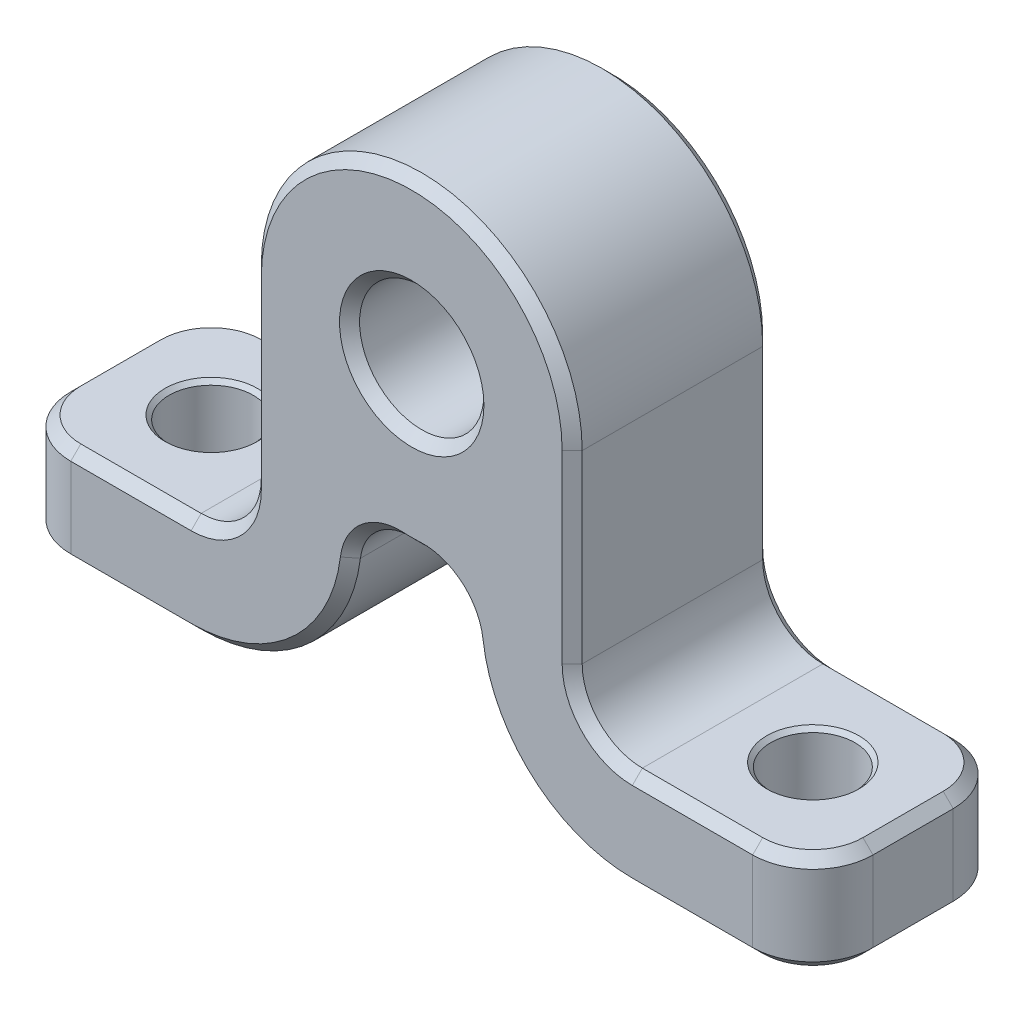
from build123d import *

# Parameters (mm, degrees)
SKETCH_1_R        = 8
SKETCH_1_R_2      = 3.1
EXTRUDE_1_DEPTH   = 5
SKETCH_1_W        = 40
SKETCH_1_H        = 5
EXTRUDE_1_2_DEPTH = 5
CHAMFER_7_SIZE    = 0.5
EXTRUDE1_START    = -10
EXTRUDE1_DEPTH    = 10
FILLET1_R         = 3
EXTRUDE2_START    = -4.5
EXTRUDE2_DEPTH    = 4.5
FILLET2_R         = 8
SKETCH3_R         = 2.1
EXTRUDE3_DEPTH    = 29.869431931
CHAMFER2_SIZE     = 0.2
EXTRUDE4_DEPTH    = 27.952441448
FILLET3_R         = 2.5
FILLET4_R         = 3
CHAMFER4_SIZE     = 0.5


with BuildPart() as part:
    # 草图1 → 凸台-拉伸1 (new, symmetric)
    with BuildSketch(Plane.XY):
        Circle(SKETCH_1_R)
        Circle(SKETCH_1_R_2, mode=Mode.SUBTRACT)
    extrude(amount=EXTRUDE_1_DEPTH, both=True)

    # 倒角7
    chamfer_7_edges = [part.edges().sort_by_distance(p)[0] for p in [
        (-3.1, 0, -5),
        (-3.1, 0, 5),
    ]]
    chamfer(chamfer_7_edges, length=CHAMFER_7_SIZE)



with BuildPart() as body_2:
    # 草图1 → Extrude 1 2 (new, symmetric)
    with BuildSketch(Plane.XY):
        with Locations((0, -14.71)):
            Rectangle(SKETCH_1_W, SKETCH_1_H)
    extrude(amount=EXTRUDE_1_2_DEPTH, both=True)


with BuildPart() as part_1:
    add(part.part)

    add(body_2.part)  # Extrude1 merges body 2
    # Sketch1 → Extrude1 (add)
    with BuildSketch(Plane(origin=(0, 0, -5), x_dir=(-1, 0, 0), z_dir=(0, 0, -1)).offset(EXTRUDE1_START)):
        with BuildLine():
            ThreePointArc((8, 0), (0, -8), (-8, 0))
            Line((-8, 0), (-8, -12.21))
            Line((-8, -12.21), (8, -12.21))
            Line((8, -12.21), (8, 0))
        make_face()
    extrude(amount=EXTRUDE1_DEPTH)

    # Fillet1
    fillet1_edges = [part_1.edges().sort_by_distance(p)[0] for p in [
        (8, -12.21, 0),
        (-8, -12.21, 0),
    ]]
    fillet(fillet1_edges, radius=FILLET1_R)

    # Sketch2 → Extrude2 (cut)
    with BuildSketch(Plane(origin=(0, 0, -5), x_dir=(-1, 0, 0), z_dir=(0, 0, -1)).offset(EXTRUDE2_START)):
        with BuildLine():
            ThreePointArc((3, -7.416198487), (0, -8), (-3, -7.416198487))
            Line((-3, -7.416198487), (-3, -17.21))
            Line((-3, -17.21), (3, -17.21))
            Line((3, -17.21), (3, -7.416198487))
        make_face()
    extrude2 = extrude(amount=EXTRUDE2_DEPTH, mode=Mode.SUBTRACT)

    # Mirror1: Extrude2 across plane
    add(extrude2.mirror(Plane.XY), mode=Mode.SUBTRACT)

    # Fillet2
    fillet2_edges = [part_1.edges().sort_by_distance(p)[0] for p in [
        (-3, -17.21, -2.75),
        (3, -17.21, -2.75),
        (3, -17.21, 2.75),
        (-3, -17.21, 2.75),
    ]]
    fillet(fillet2_edges, radius=FILLET2_R)

    # Sketch3 → Extrude3 (cut, through all)
    with BuildSketch(Plane(origin=(0, -12.21, 0), x_dir=(1, 0, 0), z_dir=(0, 1, 0))):
        with Locations(Location((15, 0, 0), (0, 0, 270))):
            Circle(SKETCH3_R)
        with Locations(Location((-15, 0, 0), (0, 0, 90))):
            Circle(SKETCH3_R)
    extrude(amount=-EXTRUDE3_DEPTH, mode=Mode.SUBTRACT)

    # Chamfer2
    chamfer2_edges = [part_1.edges().sort_by_distance(p)[0] for p in [
        (15, -17.21, -2.1),
        (15, -12.21, -2.1),
        (-15, -17.21, 2.1),
        (-15, -12.21, 2.1),
    ]]
    chamfer(chamfer2_edges, length=CHAMFER2_SIZE)

    # Sketch4 → Extrude4 (cut, through all)
    with BuildSketch(Plane(origin=(0, 0, -0.5), x_dir=(-1, 0, 0), z_dir=(0, 0, -1))):
        with BuildLine():
            Line((-11, -17.21), (11, -17.21))
            ThreePointArc((11, -17.21), (5.343145751, -14.866854249), (3, -9.21))
            Line((3, -9.21), (3, -7.416198487))
            ThreePointArc((3, -7.416198487), (0, -8), (-3, -7.416198487))
            Line((-3, -7.416198487), (-3, -9.21))
            ThreePointArc((-3, -9.21), (-5.343145751, -14.866854249), (-11, -17.21))
        make_face()
    extrude(amount=-EXTRUDE4_DEPTH, mode=Mode.SUBTRACT)

    # Fillet3
    fillet3_edges = [part_1.edges().sort_by_distance(p)[0] for p in [
        (-3, -7.416198487, 0),
        (3, -7.416198487, 0),
    ]]
    fillet(fillet3_edges, radius=FILLET3_R)

    # Fillet4
    fillet4_edges = [part_1.edges().sort_by_distance(p)[0] for p in [
        (20, -14.71, -5),
        (-20, -14.71, 5),
        (20, -14.71, 5),
        (-20, -14.71, -5),
    ]]
    fillet(fillet4_edges, radius=FILLET4_R)

    # Chamfer4
    chamfer4_edges = [part_1.edges().sort_by_distance(p)[0] for p in [
        (0, 8, 5),
        (0, -8, -5),
        (8, -4.605, -5),
        (0, -8, 5),
        (-5.697451281, -15.200240152, -5),
        (5.697451281, -15.200240152, 5),
        (-2.182501473, -8.567267514, -5),
        (-2.182501473, -8.567267514, 5),
        (8, -4.605, 5),
        (2.182501473, -8.567267514, -5),
        (2.182501473, -8.567267514, 5),
        (-14, -17.21, -5),
        (-14, -12.21, -5),
        (-14, -12.21, 5),
        (-20, -12.21, 0),
        (-19.121320344, -12.21, 4.121320344),
        (-19.121320344, -12.21, -4.121320344),
        (-20, -17.21, 0),
        (-14, -17.21, 5),
        (-19.121320344, -17.21, 4.121320344),
        (-19.121320344, -17.21, -4.121320344),
        (20, -12.21, 0),
        (20, -17.21, 0),
        (19.121320344, -12.21, 4.121320344),
        (19.121320344, -12.21, -4.121320344),
        (19.121320344, -17.21, 4.121320344),
        (19.121320344, -17.21, -4.121320344),
        (0, 8, -5),
        (-8, -4.605, 5),
        (-8, -4.605, -5),
        (14, -12.21, 5),
        (14, -12.21, -5),
        (-8.878679656, -11.331320344, -5),
        (-8.878679656, -11.331320344, 5),
        (8.878679656, -11.331320344, -5),
        (8.878679656, -11.331320344, 5),
        (14, -17.21, -5),
        (14, -17.21, 5),
        (-5.697451281, -15.200240152, 5),
        (5.697451281, -15.200240152, -5),
    ]]
    chamfer(chamfer4_edges, length=CHAMFER4_SIZE)


solid = part_1.part
